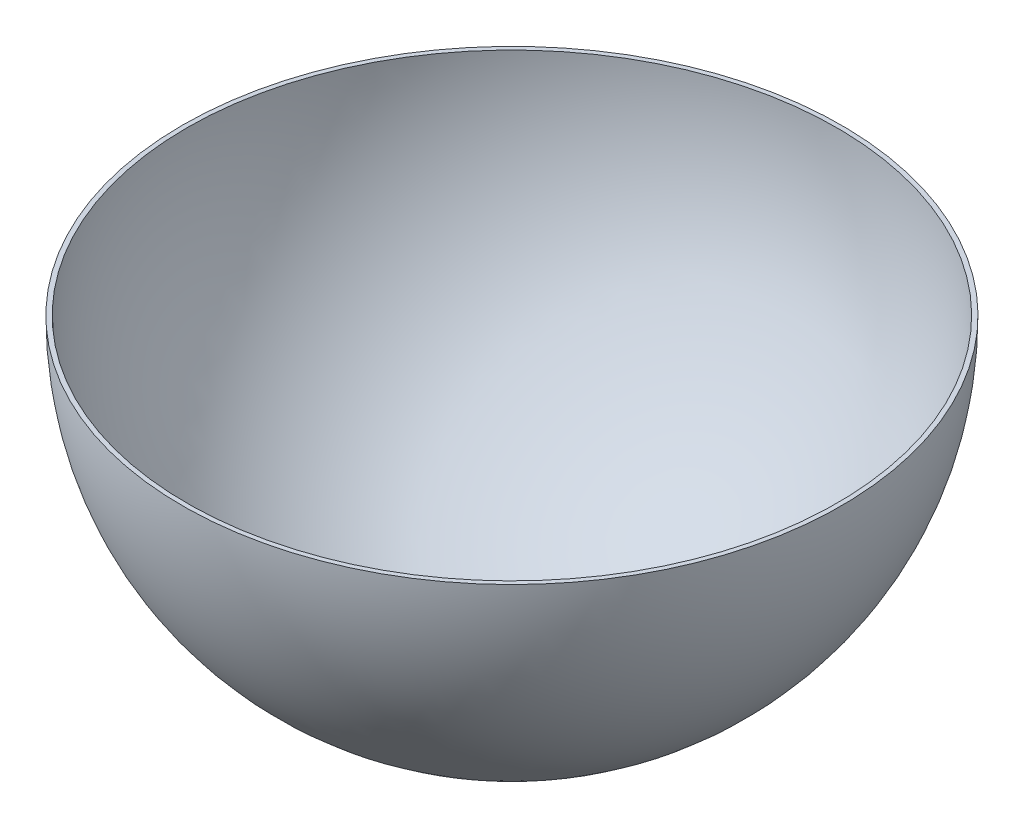
from build123d import *

# Parameters (mm, degrees)
SKETCH2_R          = 1.143
CUT_EXTRUDE1_DEPTH = 1203.198


with BuildPart() as part:
    # Sketch1 → Revolve1 (revolve)
    with BuildSketch(Plane.XY):
        with BuildLine():
            ThreePointArc((0, -294.386), (-208.162336886, -208.162336886), (-294.386, 0))
            Line((-294.386, 0), (-298.45, 0))
            ThreePointArc((-298.45, 0), (-211.036018845, -211.036018845), (0, -298.45))
            Line((0, -298.45), (0, -294.386))
        make_face()
    revolve(axis=Axis((0, 0, 0), (0, -1, 0)))

    # Sketch2 → Cut-Extrude1 (cut)
    with BuildSketch(Plane(origin=(-309.812024235, -388.251536458, -376.865657868), x_dir=(1, 0, 0), z_dir=(0, 1, 0))):
        with Locations(Location((309.812024235, -376.865657868, 0), (0, 0, 180))):
            Circle(SKETCH2_R)
    extrude(amount=CUT_EXTRUDE1_DEPTH, mode=Mode.SUBTRACT)


solid = part.part
